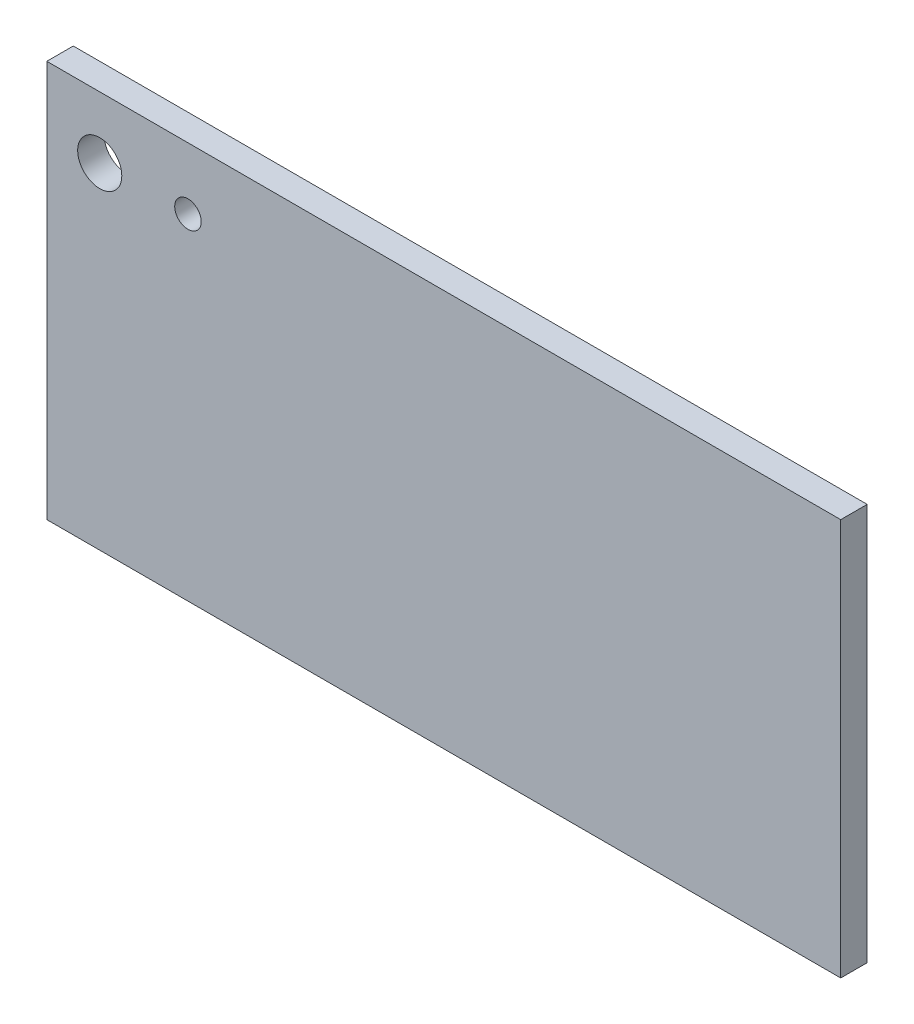
from build123d import *

# Parameters (mm, degrees)
SKETCH_1_W      = 90
SKETCH_1_H      = 45
EXTRUDE_1_DEPTH = 3
SKETCH_2_R      = 2.5
DIA_5_DEPTH     = 101.667770413
SKETCH_3_R      = 1.5
DIA_3_DEPTH     = 101.667770413


with BuildPart() as part:
    # 草圖1 → 伸長1 (new body)
    with BuildSketch(Plane.XY):
        with Locations((45, 22.5)):
            Rectangle(SKETCH_1_W, SKETCH_1_H)
    extrude(amount=EXTRUDE_1_DEPTH)

    # 草圖2 → Dia 5 (cut, through all)
    with BuildSketch(Plane.XY.offset(3)):
        with Locations((6, 38)):
            Circle(SKETCH_2_R)
    extrude(amount=-DIA_5_DEPTH, mode=Mode.SUBTRACT)

    # 草圖3 → Dia 3 (cut, through all)
    with BuildSketch(Plane.XY.offset(3)):
        with Locations((16, 38)):
            Circle(SKETCH_3_R)
    extrude(amount=-DIA_3_DEPTH, mode=Mode.SUBTRACT)


solid = part.part
